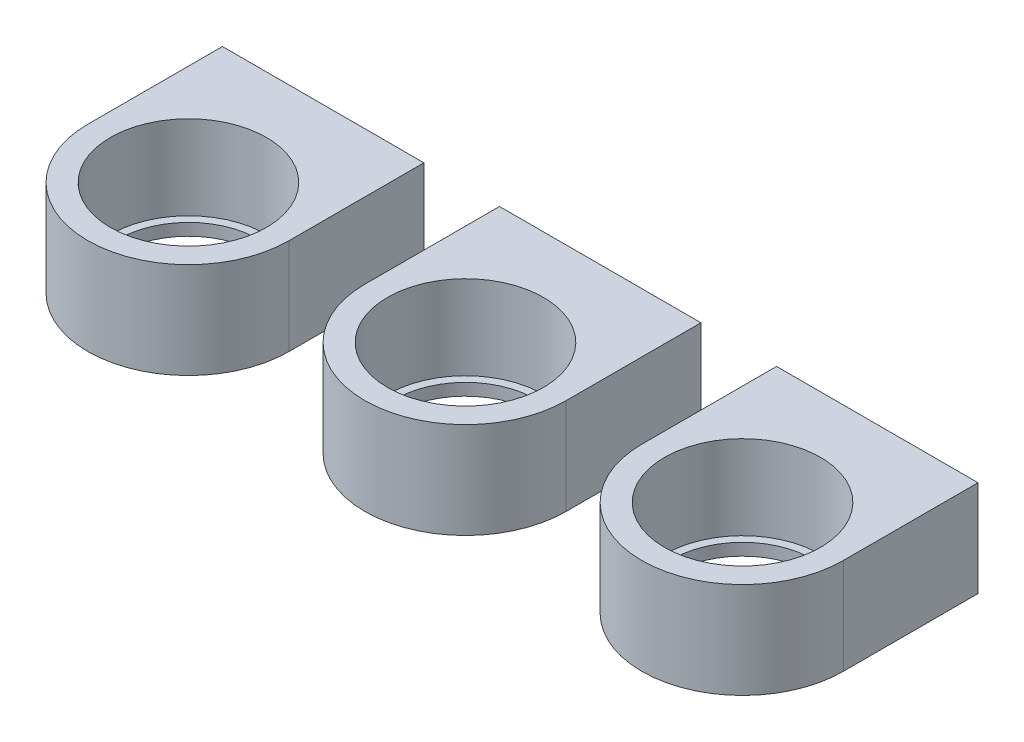
from build123d import *

# Parameters (mm, degrees)
SKETCH1_R           = 9.25
BOSS_EXTRUDE1_DEPTH = 12.7
SKETCH2_R           = 10.31875
CUT_EXTRUDE1_DEPTH  = 11.1125
BOSS_EXTRUDE2_DEPTH = 40
SKETCH4_W           = 59.346430133
SKETCH4_H           = 21.496595804
CUT_EXTRUDE2_DEPTH  = 45
SKETCH5_W           = 104.9125
SKETCH5_H           = 1.478286878
CUT_EXTRUDE3_DEPTH  = 45


with BuildPart() as part:
    # Sketch1 → Boss-Extrude1 (new body)
    with BuildSketch(Plane(origin=(0, 0, 0), x_dir=(1, 0, 0), z_dir=(0, 1, 0))):
        with BuildLine():
            Line((-13.31875, 0), (-13.31875, 13.31875))
            Line((-13.31875, 13.31875), (-13.31875, 17.81875))
            Line((-13.31875, 17.81875), (13.31875, 17.81875))
            Line((13.31875, 17.81875), (13.31875, 13.31875))
            Line((13.31875, 13.31875), (13.31875, 0))
            ThreePointArc((13.31875, 0), (0, -13.31875), (-13.31875, 0))
        make_face()
        with Locations(Location((0, 0, 0), (0, 0, 270))):
            Circle(SKETCH1_R, mode=Mode.SUBTRACT)
    extrude(amount=BOSS_EXTRUDE1_DEPTH)

    # Sketch2 → Cut-Extrude1 (cut)
    with BuildSketch(Plane(origin=(0, 12.7, 0), x_dir=(1, 0, 0), z_dir=(0, 1, 0))):
        with Locations(Location((0, 0, 0), (0, 0, 270))):
            Circle(SKETCH2_R)
    extrude(amount=-CUT_EXTRUDE1_DEPTH, mode=Mode.SUBTRACT)

    # Sketch3 → Boss-Extrude2 (add)
    with BuildSketch(Plane(origin=(0, 0, -17.81875), x_dir=(-1, 0, 0), z_dir=(0, 0, -1))):
        Polygon((0, 0), (-18.31875, 0), (-18.31875, -1.478286878), (18.31875, -1.478286878), (18.31875, 0), align=None)
    extrude(amount=-BOSS_EXTRUDE2_DEPTH)

    # Mirror2: part across plane


with BuildPart() as part_1:
    add(part.part)
    add(part.part.mirror(Plane.ZY.offset(18.31875)))

    # Mirror4: part across plane


with BuildPart() as part_2:
    add(part_1.part)
    add(part_1.part.mirror(Plane(origin=(18.31875, 0, 0), x_dir=(0, 0, 1), z_dir=(1, 0, 0))))

    # Sketch4 → Cut-Extrude2 (cut)
    with BuildSketch(Plane(origin=(49.95625, 0, 0), x_dir=(0, 0, -1), z_dir=(1, 0, 0))):
        with Locations((2.088766469, 4.510636286)):
            Rectangle(SKETCH4_W, SKETCH4_H)
    extrude(amount=CUT_EXTRUDE2_DEPTH, mode=Mode.SUBTRACT)

    # Sketch5 → Cut-Extrude3 (cut)
    with BuildSketch(Plane(origin=(0, 0, -17.81875), x_dir=(-1, 0, 0), z_dir=(0, 0, -1))):
        with Locations((2.5, -0.739143439)):
            Rectangle(SKETCH5_W, SKETCH5_H)
    extrude(amount=-CUT_EXTRUDE3_DEPTH, mode=Mode.SUBTRACT)


with BuildPart() as cut_extrude3_piece_1:
    # of the separate pieces the step leaves, piece 1, a body of its own (cut_extrude3_pieces)
    add(part_2.part.solids().sort_by_distance((13.31875, 0, -17.81875))[0])


with BuildPart() as cut_extrude3_piece_2:
    # of the separate pieces the step leaves, piece 2, a body of its own (cut_extrude3_pieces)
    add(part_2.part.solids().sort_by_distance((23.31875, 0, -17.81875))[0])


with BuildPart() as cut_extrude3_piece_3:
    # of the separate pieces the step leaves, piece 3, a body of its own (cut_extrude3_pieces)
    add(part_2.part.solids().sort_by_distance((-49.95625, 0, -17.81875))[0])


solid = Compound([cut_extrude3_piece_1.part, cut_extrude3_piece_2.part, cut_extrude3_piece_3.part])
